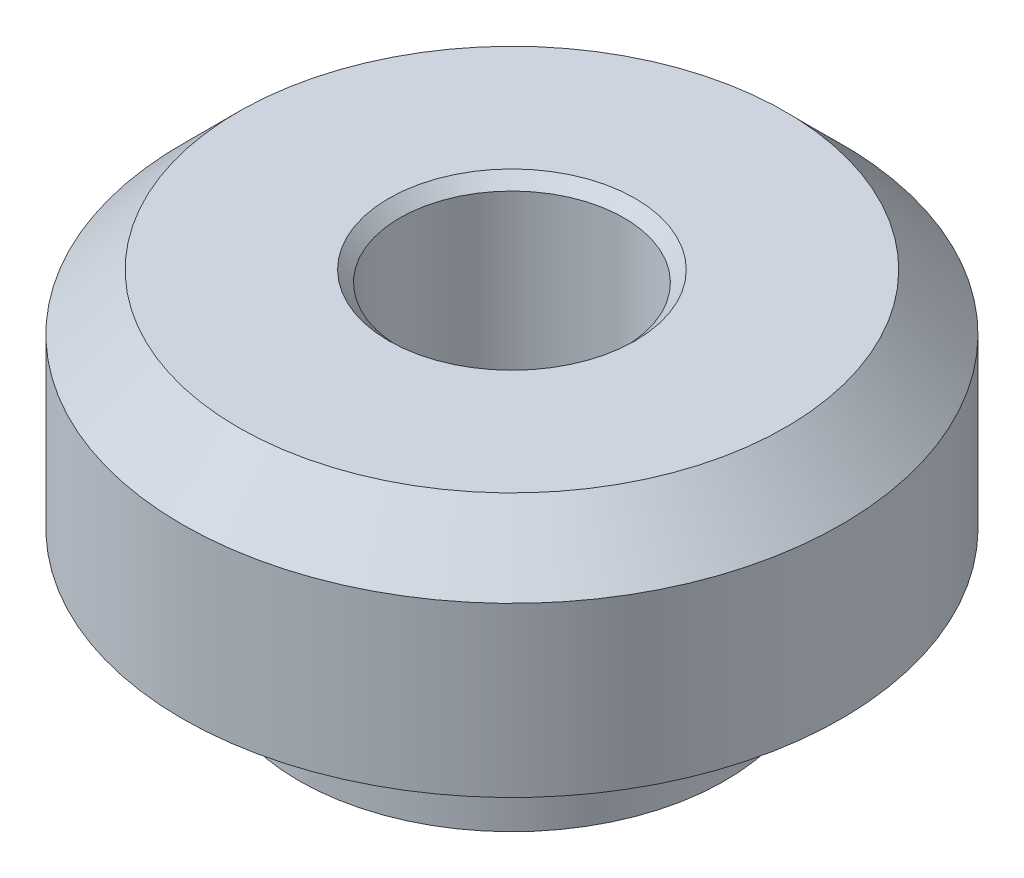
from build123d import *

# Parameters (mm, degrees)
SKETCH1_R           = 1.9
BOSS_EXTRUDE1_DEPTH = 1
SKETCH2_R           = 2.940420278
BOSS_EXTRUDE2_DEPTH = 2
CHAMFER1_SIZE       = 0.5
SKETCH3_R           = 1
CUT_EXTRUDE1_DEPTH  = 4
CHAMFER2_SIZE       = 0.1


with BuildPart() as part:
    # Sketch1 → Boss-Extrude1 (new body)
    with BuildSketch(Plane(origin=(0, 0, 0), x_dir=(1, 0, 0), z_dir=(0, 1, 0))):
        with Locations(Location((0, 0, 0), (0, 0, 270))):
            Circle(SKETCH1_R)
    extrude(amount=BOSS_EXTRUDE1_DEPTH)

    # Sketch2 → Boss-Extrude2 (add)
    with BuildSketch(Plane(origin=(0, 1, 0), x_dir=(1, 0, 0), z_dir=(0, 1, 0))):
        with Locations(Location((0, 0, 0), (0, 0, 270))):
            Circle(SKETCH2_R)
    extrude(amount=BOSS_EXTRUDE2_DEPTH)

    # Chamfer1
    chamfer1_edges = [part.edges().sort_by_distance(p)[0] for p in [
        (0, 3, -2.940420278),
    ]]
    chamfer(chamfer1_edges, length=CHAMFER1_SIZE)

    # Sketch3 → Cut-Extrude1 (cut)
    with BuildSketch(Plane(origin=(0, 3, 0), x_dir=(1, 0, 0), z_dir=(0, 1, 0))):
        with Locations(Location((0, 0, 0), (0, 0, 270))):
            Circle(SKETCH3_R)
    extrude(amount=-CUT_EXTRUDE1_DEPTH, mode=Mode.SUBTRACT)

    # Chamfer2
    chamfer2_edges = [part.edges().sort_by_distance(p)[0] for p in [
        (0, 3, -1),
    ]]
    chamfer(chamfer2_edges, length=CHAMFER2_SIZE)


solid = part.part
